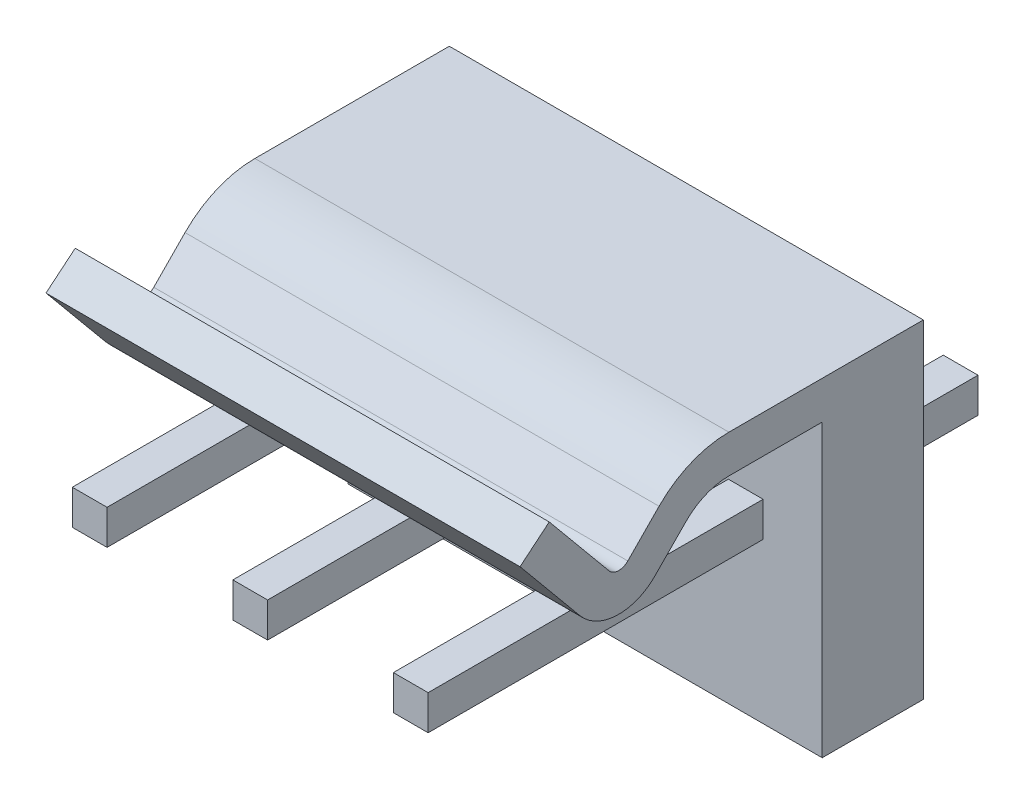
from build123d import *

# Parameters (mm, degrees)
SKETCH_2_W           = 15
SKETCH_2_H           = 10.4
EXTRUDE_1_DEPTH      = 3.2
EXTRUDE_2_DEPTH      = 13.8
EXTRUDE_2_DEPTH_BACK = 3.6
SKETCH_3_W           = 1.1
SKETCH_3_H           = 1.1
SKETCH_5_W           = 15
SKETCH_5_H           = 1.2
SKETCH_6_R           = 0.325501749
CUT_EXTRUDE_1_DEPTH  = 2


with BuildPart() as part:
    # Эскиз2 → Вытянуть1 (new body)
    with BuildSketch(Plane.XY):
        with Locations((5.08, -0.4)):
            Rectangle(SKETCH_2_W, SKETCH_2_H)
    extrude(amount=EXTRUDE_1_DEPTH)

    # Эскиз3 → Вытянуть2 (add, two sides: drawn at the far end of the back side and taken through both)
    with BuildSketch(Plane.XY.offset(-EXTRUDE_2_DEPTH_BACK)):
        Rectangle(SKETCH_3_W, SKETCH_3_H)
        with Locations((5.08, 0)):
            Rectangle(SKETCH_3_W, SKETCH_3_H)
        with Locations((10.16, 0)):
            Rectangle(SKETCH_3_W, SKETCH_3_H)
    extrude(amount=EXTRUDE_2_DEPTH + EXTRUDE_2_DEPTH_BACK)

    # По траектории1: sweep along a path in Эскиз4
    with BuildLine(Plane.ZY.offset(2.42)) as sweep_1_path:
        Line((3.2, 4.2), (6.152565934, 4.2))
        ThreePointArc((6.152565934, 4.2), (7.118635036, 4.005799317), (7.934615114, 3.453368392))
        Line((7.934615114, 3.453368392), (8.923160693, 2.448652643))
        ThreePointArc((8.923160693, 2.448652643), (9.678881269, 2.150920668), (10.406297634, 2.512339193))
        Line((10.406297634, 2.512339193), (12.3, 4.8))
    # Эскиз5 → По траектории1 (sweep)
    with BuildSketch(Plane.XY.offset(3.2)):
        with Locations((5.08, 4.2)):
            Rectangle(SKETCH_5_W, SKETCH_5_H)
    sweep(path=sweep_1_path.line)

    # Эскиз6 → Вырез-Вытянуть1 (cut)
    with BuildSketch(Plane(origin=(0, 0, -3.6), x_dir=(-1, 0, 0), z_dir=(0, 0, -1))):
        Circle(SKETCH_6_R)
    extrude(amount=-CUT_EXTRUDE_1_DEPTH, mode=Mode.SUBTRACT)


solid = part.part
